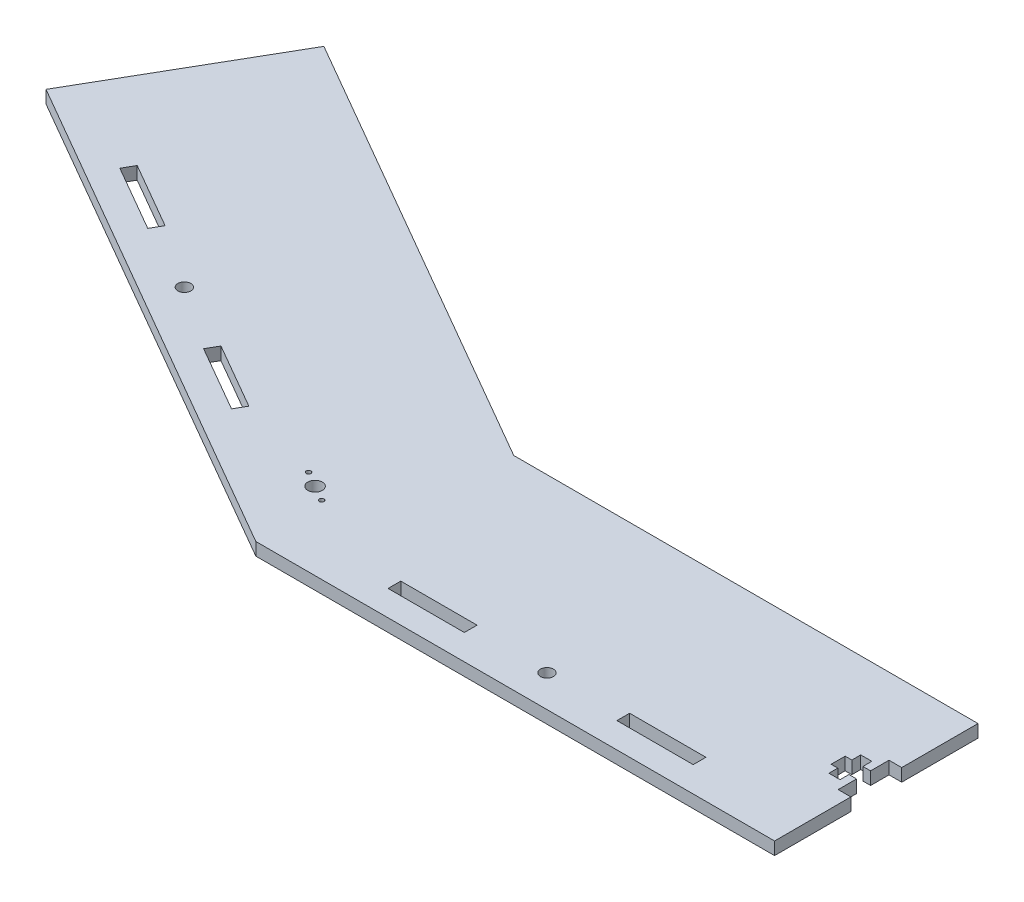
from build123d import *

# Parameters (mm, degrees)
SKETCH1_R           = 0.5842
SKETCH1_R_2         = 1.8161
SKETCH1_R_3         = 1.6256
SKETCH1_W           = 19.05
SKETCH1_H           = 3.175
BOSS_EXTRUDE2_DEPTH = 3.175


with BuildPart() as part:
    # Sketch1 → Boss-Extrude2 (new body)
    with BuildSketch(Plane(origin=(0, 0, 0), x_dir=(1, 0, 0), z_dir=(0, 1, 0))):
        Polygon((13.611818976, 50.8), (129.54, 50.8), (129.54, 31.75), (126.365, 31.75), (126.365, 27.1526), (124.46, 27.1526), (124.46, 29.36875), (121.681875, 29.36875), (121.681875, 27.1526), (120.015, 27.1526), (120.015, 23.6474), (121.681875, 23.6474), (121.681875, 21.43125), (124.46, 21.43125), (124.46, 23.6474), (126.365, 23.6474), (126.365, 19.05), (129.54, 19.05), (129.54, 0), (0, 0), (-123.973111831, 71.575909488), (-98.573111831, 115.57), align=None)
        with Locations(Location((-8.398663944, 21.566725284, 0), (0, 0, 270))):
            Circle(SKETCH1_R, mode=Mode.SUBTRACT)
        with Locations(Location((-4.549181024, 19.344225284, 0), (0, 0, 270))):
            Circle(SKETCH1_R_2, mode=Mode.SUBTRACT)
        with Locations(Location((-0.699698105, 17.121725284, 0), (0, 0, 270))):
            Circle(SKETCH1_R, mode=Mode.SUBTRACT)
        with Locations(Location((-63.911896428, 46.06498613, 0), (0, 0, 270))):
            Circle(SKETCH1_R_3, mode=Mode.SUBTRACT)
        with Locations(Location((64.77, 7.9375, 0), (0, 0, 270))):
            Circle(SKETCH1_R_3, mode=Mode.SUBTRACT)
        Polygon((-96.113714312, 66.489801459), (-79.61593037, 56.964801459), (-81.20343037, 54.215170802), (-97.701214312, 63.740170802), align=None, mode=Mode.SUBTRACT)
        Polygon((-46.620362486, 37.914801459), (-30.122578543, 28.389801459), (-31.710078543, 25.640170802), (-48.207862486, 35.165170802), align=None, mode=Mode.SUBTRACT)
        with Locations((36.195, 7.9375)):
            Rectangle(SKETCH1_W, SKETCH1_H, mode=Mode.SUBTRACT)
        with Locations((93.345, 7.9375)):
            Rectangle(SKETCH1_W, SKETCH1_H, mode=Mode.SUBTRACT)
    extrude(amount=BOSS_EXTRUDE2_DEPTH)


solid = part.part
